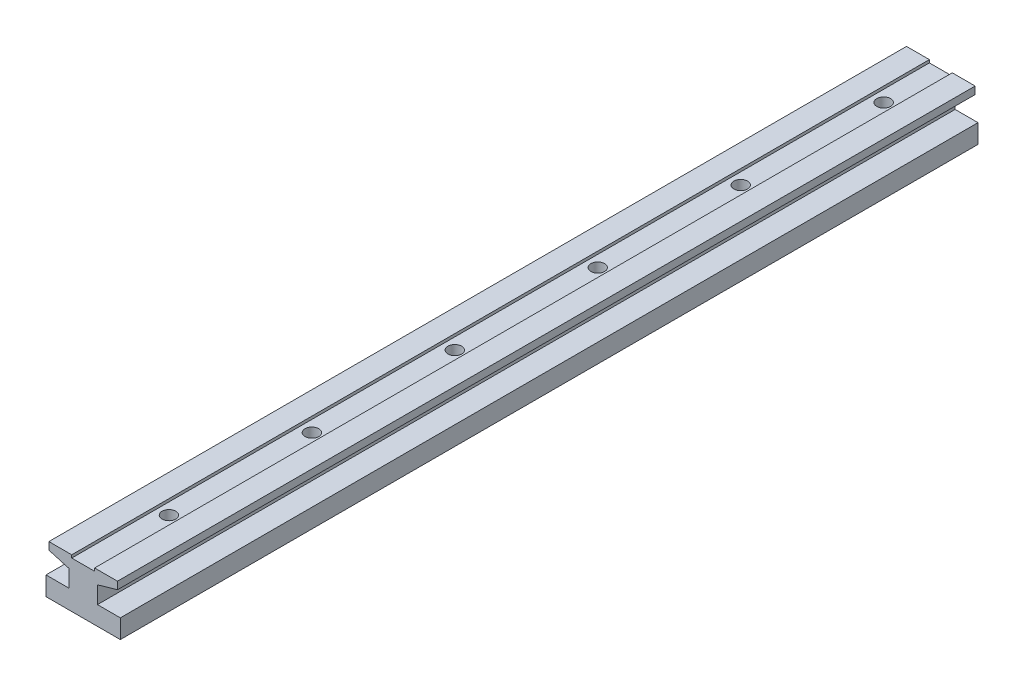
from build123d import *

# Parameters (mm, degrees)
AUFSATZ_LINEAR_AUSTRAGEN1_DEPTH                      = 150
STIRNSENKUNG_F_R_M2_FLACHKOPFSCHRAUBE_MI_D           = 2.4
STIRNSENKUNG_F_R_M2_FLACHKOPFSCHRAUBE_MI_CBORE_D     = 5
STIRNSENKUNG_F_R_M2_FLACHKOPFSCHRAUBE_MI_CBORE_DEPTH = 1.6


with BuildPart() as part:
    # Skizze1 → Aufsatz-Linear austragen1 (new body)
    with BuildSketch(Plane.XY):
        Polygon((0, 0), (-6.5, 0), (-6.5, 3.3), (-2.5, 3.3), (-2.5, 6.3), (-6, 7.3), (-6, 8.6), (-2, 8.6), (-2, 8.1), (2, 8.1), (2, 8.6), (6, 8.6), (6, 7.3), (2.5, 6.3), (2.5, 3.3), (6.5, 3.3), (6.5, 0), align=None)
    extrude(amount=AUFSATZ_LINEAR_AUSTRAGEN1_DEPTH)

    # Stirnsenkung für M2 Flachkopfschraube mit Schlitz1 (through all)
    with Locations(Plane(origin=(0, 0, 0), x_dir=(-1, 0, 0), z_dir=(0, -1, 0))):
        with Locations((0, -85), (0, -60), (0, -35), (0, -10), (0, -110), (0, -135)):
            CounterBoreHole(STIRNSENKUNG_F_R_M2_FLACHKOPFSCHRAUBE_MI_D / 2, STIRNSENKUNG_F_R_M2_FLACHKOPFSCHRAUBE_MI_CBORE_D / 2, STIRNSENKUNG_F_R_M2_FLACHKOPFSCHRAUBE_MI_CBORE_DEPTH)


solid = part.part
